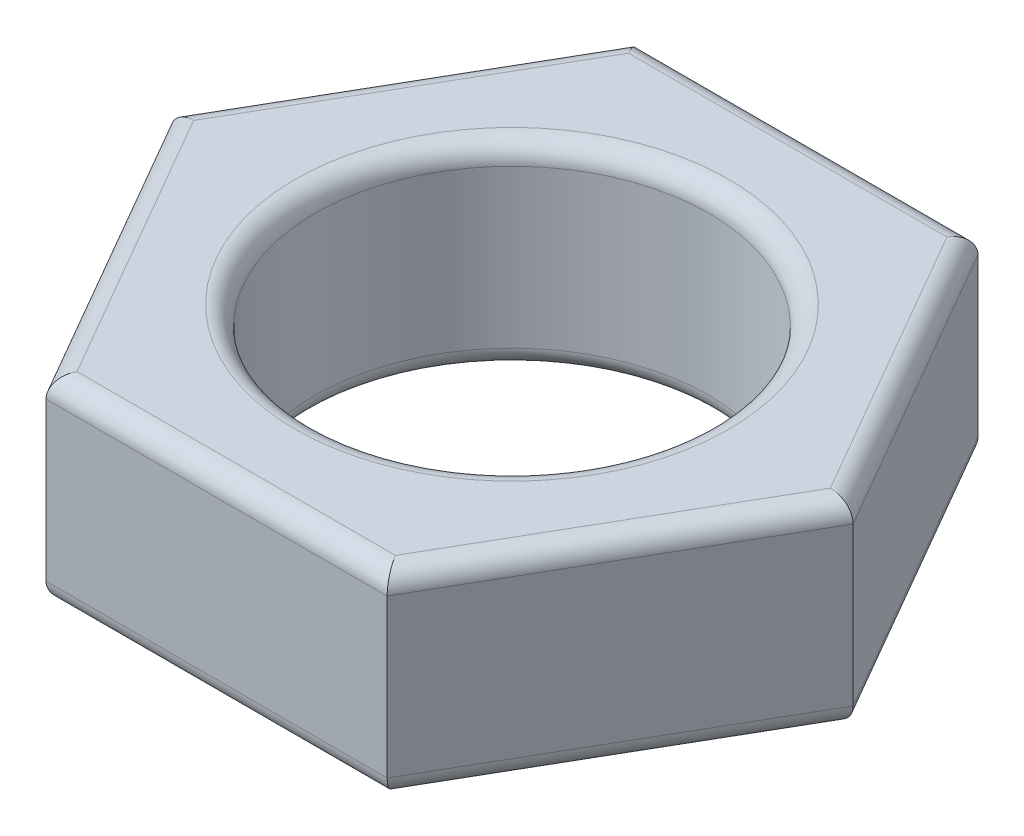
from build123d import *

# Parameters (mm, degrees)
SKETCH1_R           = 5
BOSS_EXTRUDE1_DEPTH = 5
FILLET1_R           = 0.5


with BuildPart() as part:
    # Sketch1 → Boss-Extrude1 (new body)
    with BuildSketch(Plane(origin=(0, 0, 0), x_dir=(1, 0, 0), z_dir=(0, 1, 0))):
        Polygon((4.330127019, -7.5), (8.660254038, 0), (4.330127019, 7.5), (-4.330127019, 7.5), (-8.660254038, 0), (-4.330127019, -7.5), align=None)
        with Locations(Location((0, 0, 0), (0, 0, 270))):
            Circle(SKETCH1_R, mode=Mode.SUBTRACT)
    extrude(amount=BOSS_EXTRUDE1_DEPTH)

    # Fillet1
    fillet1_edges = [part.edges().sort_by_distance(p)[0] for p in [
        (6.495190528, 5, -3.75),
        (0, 5, -7.5),
        (-6.495190528, 5, -3.75),
        (0, 0, -5),
        (0, 5, -5),
        (-6.495190528, 5, 3.75),
        (0, 5, 7.5),
        (-6.495190528, 0, 3.75),
        (-6.495190528, 0, -3.75),
        (0, 0, -7.5),
        (6.495190528, 5, 3.75),
        (6.495190528, 0, -3.75),
        (6.495190528, 0, 3.75),
        (0, 0, 7.5),
    ]]
    fillet(fillet1_edges, radius=FILLET1_R)


solid = part.part
